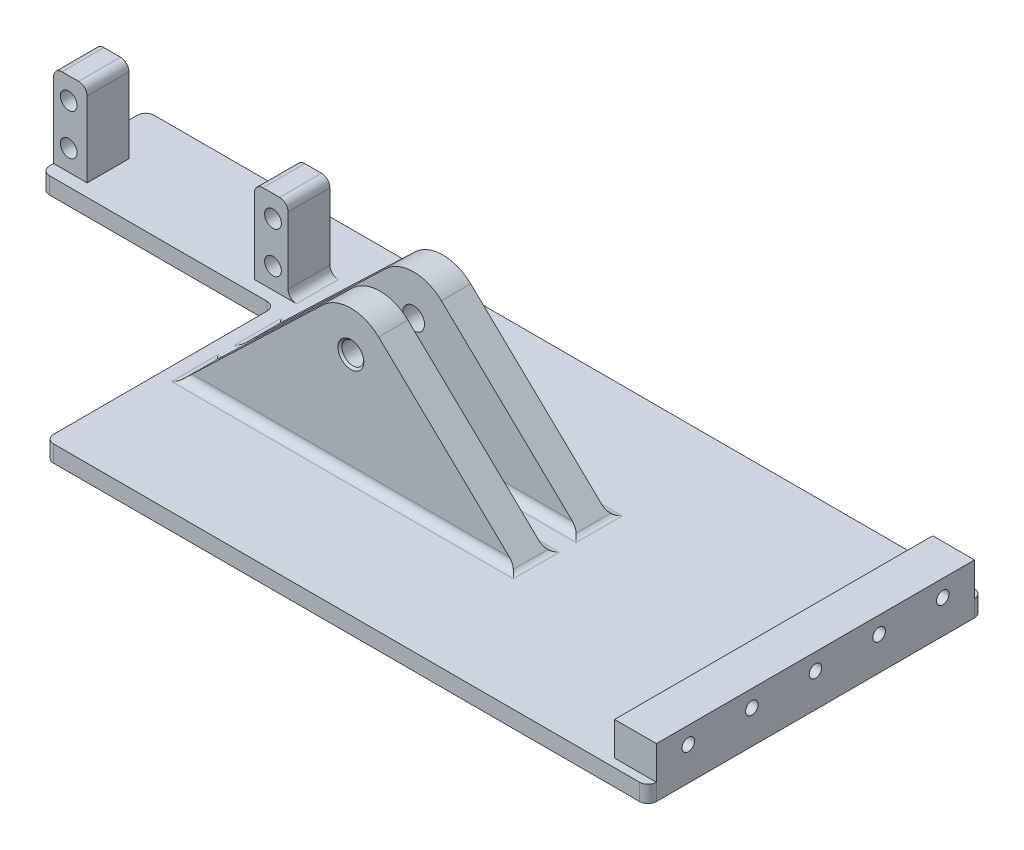
from build123d import *

# Parameters (mm, degrees)
SKETCH1_R           = 2.6
BOSS_EXTRUDE1_DEPTH = 22
SKETCH2_W           = 200
SKETCH2_H           = 80
BOSS_EXTRUDE2_DEPTH = 4
SKETCH3_W           = 8
SKETCH3_H           = 35
CUT_EXTRUDE1_DEPTH  = 209.42744541
CHAMFER1_SIZE       = 0.5
BOSS_EXTRUDE3_START = -22
SKETCH4_W           = 8
SKETCH4_H           = 20
SKETCH4_R           = 2
BOSS_EXTRUDE3_DEPTH = 10
SKETCH5_W           = 56
SKETCH5_H           = 55
CUT_EXTRUDE2_DEPTH  = 7
FILLET1_R           = 2
SKETCH7_W           = 76
SKETCH7_H           = 8
SKETCH7_R           = 1.5
BOSS_EXTRUDE4_DEPTH = 10


with BuildPart() as part:
    # Sketch1 → Boss-Extrude1 (new body)
    with BuildSketch(Plane.XY):
        with BuildLine():
            Line((-6.63831163, 6.934898608), (-40, -25))
            Line((-40, -25), (40, -25))
            Line((40, -25), (6.63831163, 6.934898608))
            ThreePointArc((6.63831163, 6.934898608), (0, 9.6), (-6.63831163, 6.934898608))
        make_face()
        Circle(SKETCH1_R, mode=Mode.SUBTRACT)
    extrude(amount=BOSS_EXTRUDE1_DEPTH)

    # Sketch2 → Boss-Extrude2 (add)
    with BuildSketch(Plane(origin=(0, -25, 0), x_dir=(-1, 0, 0), z_dir=(0, -1, 0))):
        with Locations((0, -11)):
            Rectangle(SKETCH2_W, SKETCH2_H)
    extrude(amount=BOSS_EXTRUDE2_DEPTH)

    # Sketch3 → Cut-Extrude1 (cut, through all)
    with BuildSketch(Plane(origin=(100, 0, 0), x_dir=(0, 0, -1), z_dir=(1, 0, 0))):
        with Locations((-11, -7.5)):
            Rectangle(SKETCH3_W, SKETCH3_H)
    extrude(amount=-CUT_EXTRUDE1_DEPTH, mode=Mode.SUBTRACT)

    # Chamfer1
    chamfer1_edges = [part.edges().sort_by_distance(p)[0] for p in [
        (-2.6, 0, 0),
        (-2.6, 0, 22),
    ]]
    chamfer(chamfer1_edges, length=CHAMFER1_SIZE)

    # Sketch4 → Boss-Extrude3 (add)
    # profile 1 of 2: a face of its own
    with BuildSketch(Plane(origin=(0, 0, -29), x_dir=(-1, 0, 0), z_dir=(0, 0, -1)).offset(BOSS_EXTRUDE3_START)):
        with Locations((96, -15)):
            Rectangle(SKETCH4_W, SKETCH4_H)
        with Locations((96.4, -20)):
            Circle(SKETCH4_R, mode=Mode.SUBTRACT)
        with Locations((96.4, -10.2)):
            Circle(SKETCH4_R, mode=Mode.SUBTRACT)
    # profile 2 of 2: a face of its own
    with BuildSketch(Plane(origin=(0, 0, -29), x_dir=(-1, 0, 0), z_dir=(0, 0, -1)).offset(BOSS_EXTRUDE3_START)):
        with Locations((48, -15)):
            Rectangle(SKETCH4_W, SKETCH4_H)
        with Locations(Location((47.6, -20, 0), (0, 0, 180))):
            Circle(SKETCH4_R, mode=Mode.SUBTRACT)
        with Locations(Location((47.6, -10.2, 0), (0, 0, 180))):
            Circle(SKETCH4_R, mode=Mode.SUBTRACT)
    extrude(amount=BOSS_EXTRUDE3_DEPTH)

    # Sketch5 → Cut-Extrude2 (cut)
    with BuildSketch(Plane(origin=(0, -25, 0), x_dir=(1, 0, 0), z_dir=(0, 1, 0))):
        with Locations((-72, -23.5)):
            Rectangle(SKETCH5_W, SKETCH5_H)
    extrude(amount=-CUT_EXTRUDE2_DEPTH, mode=Mode.SUBTRACT)

    # Fillet1
    fillet1_edges = [part.edges().sort_by_distance(p)[0] for p in [
        (-100, -5, -12),
        (-92, -5, -12),
        (-44, -5, -12),
        (-52, -5, -12),
        (-44, -25, -12),
        (0, -25, 0),
        (0, -25, 15),
        (-40, -25, 18.5),
        (0, -25, 7),
        (-40, -25, 3.5),
        (0, -25, 22),
        (40, -25, 3.5),
        (40, -25, 18.5),
        (100, -27, -29),
        (100, -27, 51),
        (-100, -27, -29),
        (-44, -27, -4),
        (-44, -27, 51),
        (-100, -27, -4),
    ]]
    fillet(fillet1_edges, radius=FILLET1_R)

    # Sketch7 → Boss-Extrude4 (add)
    with BuildSketch(Plane(origin=(100, 0, 0), x_dir=(0, 0, -1), z_dir=(1, 0, 0))):
        with Locations((-11, -21)):
            Rectangle(SKETCH7_W, SKETCH7_H)
        with Locations((-41.4, -21)):
            Circle(SKETCH7_R, mode=Mode.SUBTRACT)
        with Locations((-26.2, -21)):
            Circle(SKETCH7_R, mode=Mode.SUBTRACT)
        with Locations((-11, -21)):
            Circle(SKETCH7_R, mode=Mode.SUBTRACT)
        with Locations((4.2, -21)):
            Circle(SKETCH7_R, mode=Mode.SUBTRACT)
        with Locations((19.4, -21)):
            Circle(SKETCH7_R, mode=Mode.SUBTRACT)
    extrude(amount=-BOSS_EXTRUDE4_DEPTH)


solid = part.part
